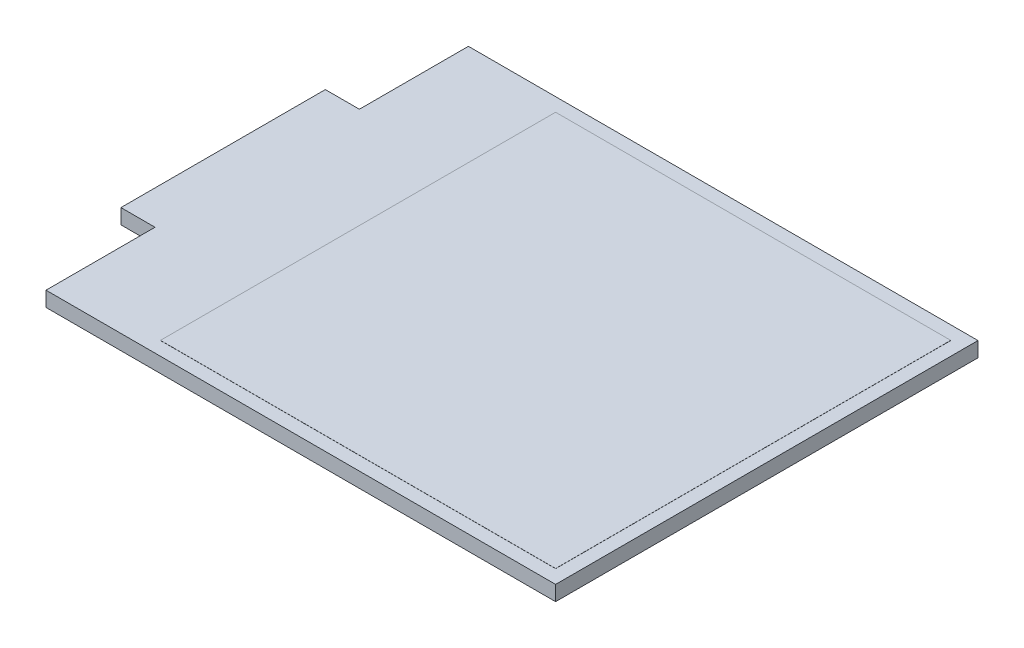
from build123d import *

# Parameters (mm, degrees)
SKETCH1_W           = 29
SKETCH1_H           = 29
BOSS_EXTRUDE1_DEPTH = 0.01
BOSS_EXTRUDE2_DEPTH = 1.1


with BuildPart() as part:
    # Sketch1 → Boss-Extrude1 (new body)
    with BuildSketch(Plane(origin=(0, 0, 0), x_dir=(1, 0, 0), z_dir=(0, 1, 0))):
        Rectangle(SKETCH1_W, SKETCH1_H)
    extrude(amount=BOSS_EXTRUDE1_DEPTH)

    # Sketch2 → Boss-Extrude2 (add)
    with BuildSketch(Plane.XZ):
        Polygon((-21.9, 15.5), (-21.9, 7.5), (-24.4, 7.5), (-24.4, -7.5), (-21.9, -7.5), (-21.9, -15.5), (15.5, -15.5), (15.5, 15.5), align=None)
    extrude(amount=BOSS_EXTRUDE2_DEPTH)


solid = part.part
